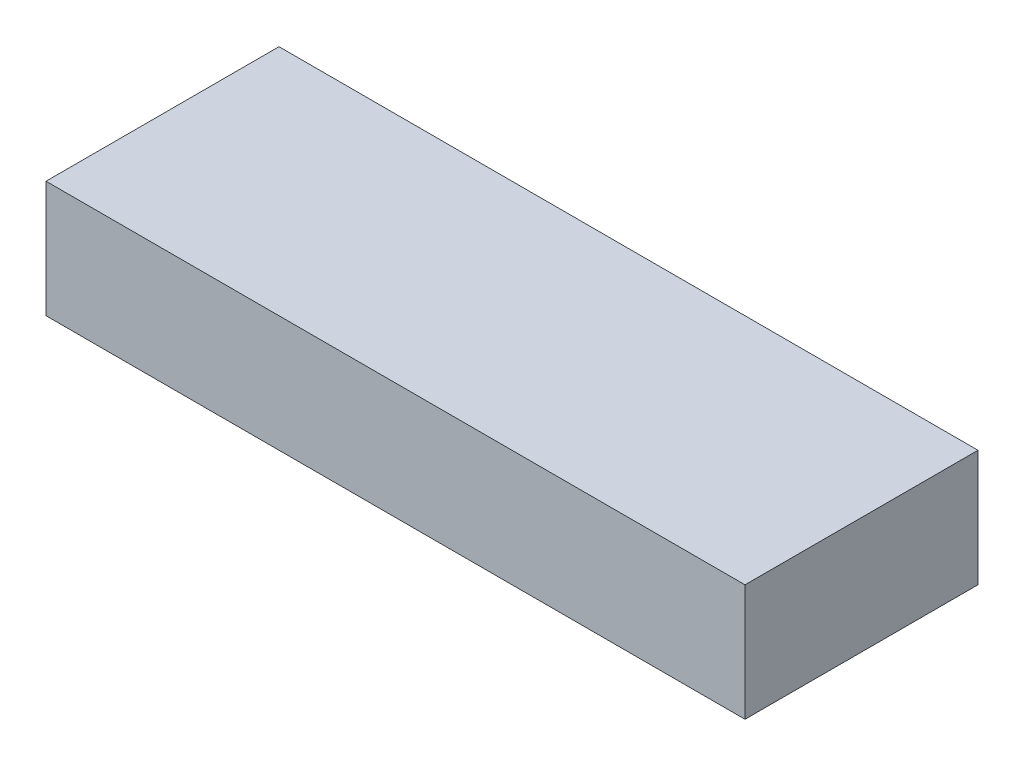
from build123d import *

# Parameters (mm, degrees)
SKETCH1_W           = 76.2
SKETCH1_H           = 25.4
BOSS_EXTRUDE1_DEPTH = 6.35


with BuildPart() as part:
    # Sketch1 → Boss-Extrude1 (new, symmetric)
    with BuildSketch(Plane(origin=(0, 0, 0), x_dir=(1, 0, 0), z_dir=(0, 1, 0))):
        Rectangle(SKETCH1_W, SKETCH1_H)
    extrude(amount=BOSS_EXTRUDE1_DEPTH, both=True)


solid = part.part
